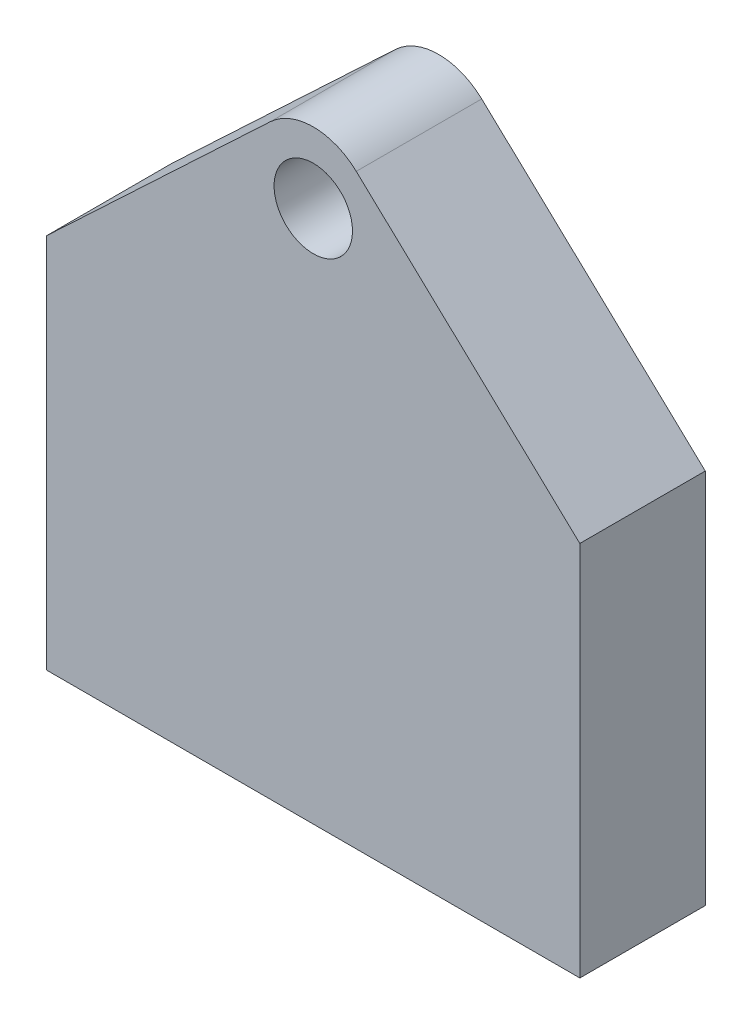
from build123d import *

# Parameters (mm, degrees)
BOSS_EXTRUDE1_DEPTH = 25.4
FILLET1_R           = 12.7
SKETCH2_R           = 7.9375
CUT_EXTRUDE1_DEPTH  = 25.4


with BuildPart() as part:
    # Sketch1 → Boss-Extrude1 (new body)
    with BuildSketch(Plane.XY):
        Polygon((-53.975, 0), (53.975, 0), (53.975, 76.2), (0, 127), (-53.975, 76.2), align=None)
    extrude(amount=BOSS_EXTRUDE1_DEPTH)

    # Fillet1
    fillet1_edges = [part.edges().sort_by_distance(p)[0] for p in [
        (0, 127, 12.7),
    ]]
    fillet(fillet1_edges, radius=FILLET1_R)

    # Sketch2 → Cut-Extrude1 (cut)
    with BuildSketch(Plane.XY.offset(25.4)):
        with Locations((0, 107.95)):
            Circle(SKETCH2_R)
    extrude(amount=-CUT_EXTRUDE1_DEPTH, mode=Mode.SUBTRACT)


solid = part.part
